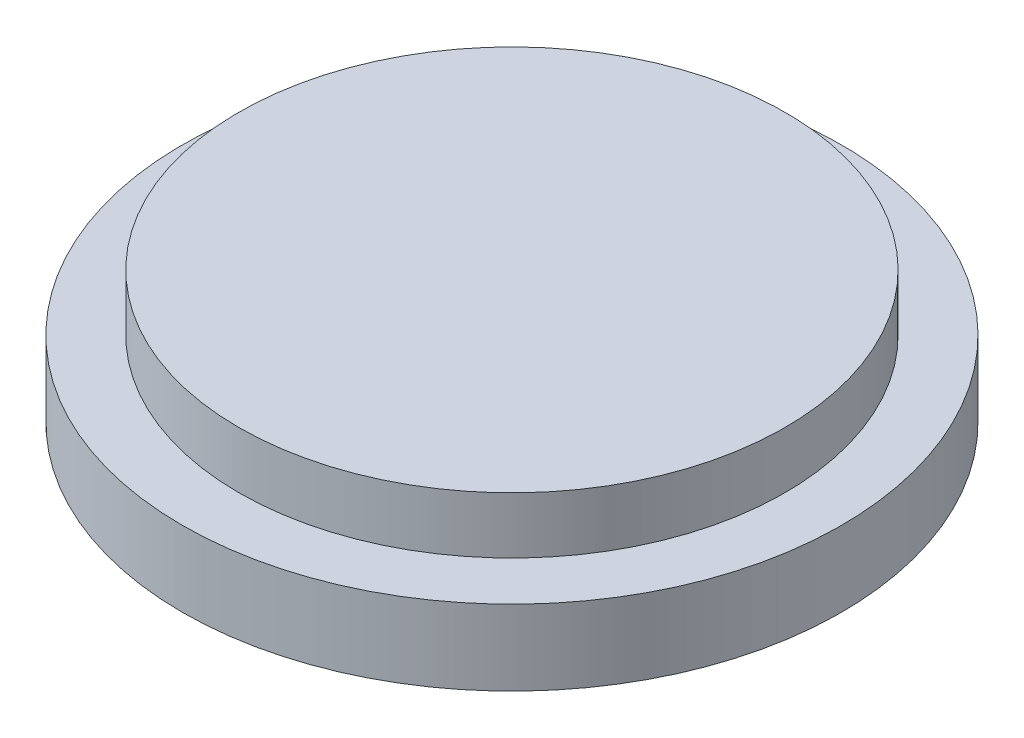
from build123d import *

# Parameters (mm, degrees)
CAP_HEAD_SKETCH_R = 35
CAP_HEAD_DEPTH    = 8
CAP_PLUG_SKETCH_R = 29
CAP_PLUG_DEPTH    = 14


with BuildPart() as part:
    # Cap Head Sketch → Cap Head (new body)
    with BuildSketch(Plane(origin=(0, 0, 0), x_dir=(1, 0, 0), z_dir=(0, 1, 0))):
        with Locations(Location((0, 0, 0), (0, 0, 270))):
            Circle(CAP_HEAD_SKETCH_R)
    extrude(amount=CAP_HEAD_DEPTH)

    # Cap Plug Sketch → Cap Plug (add)
    with BuildSketch(Plane(origin=(0, 0, 0), x_dir=(1, 0, 0), z_dir=(0, 1, 0))):
        with Locations(Location((0, 0, 0), (0, 0, 270))):
            Circle(CAP_PLUG_SKETCH_R)
    extrude(amount=CAP_PLUG_DEPTH)


solid = part.part
